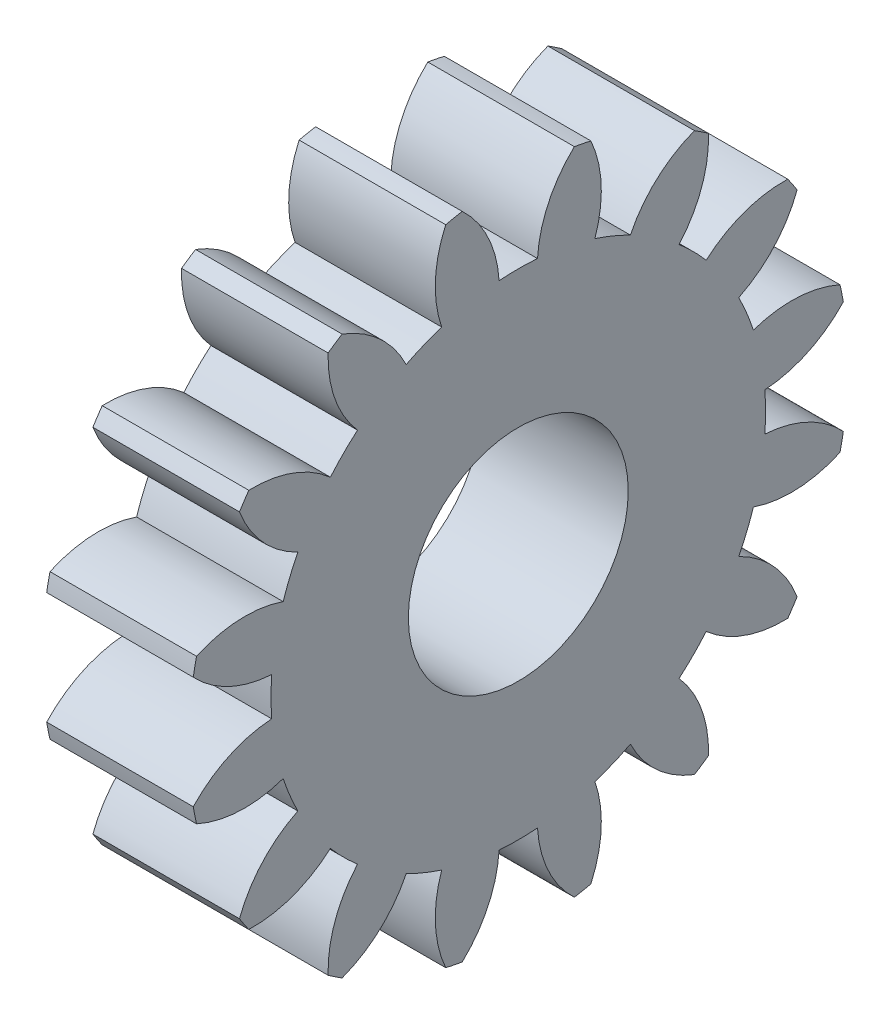
from build123d import *

# Parameters (mm, degrees)
BASPROSKE_W     = 2
BASPROSKE_H     = 4.5
TOOTHCUT_DEPTH  = 7.670832032
TEETHCUTS_COUNT = 16
TEETHCUTS_ANGLE = 337.5
BORSKE_R        = 1.5
BORE_DEPTH      = 50.0000508


with BuildPart() as part:
    # BasProSke → Base-Revolve (revolve)
    with BuildSketch(Plane(origin=(0, 0, 0), x_dir=(1, 0, 0), z_dir=(0, 1, 0)), mode=Mode.PRIVATE) as base_revolve_sk:
        with Locations((1, 2.25)):
            Rectangle(BASPROSKE_W, BASPROSKE_H)
    revolve(base_revolve_sk.sketch.rotate(Axis((-10, 0, 0), (1, 0, 0)), 180), axis=Axis((-10, 0, 0), (1, 0, 0)))

    # TooCutSke → ToothCut (cut, through all)
    with BuildSketch(Plane(origin=(0, 0, 0), x_dir=(0, 0, -1), z_dir=(1, 0, 0))):
        with BuildLine():
            ThreePointArc((0.261866103, 3.363822549), (0, 3.374), (-0.261866103, 3.363822549))
            ThreePointArc((-0.261866103, 3.363822549), (-0.417714668, 3.961827375), (-0.788562282, 4.456165918))
            ThreePointArc((-0.788562282, 4.456165918), (0, 4.5254), (0.788562282, 4.456165918))
            ThreePointArc((0.788562282, 4.456165918), (0.417714668, 3.961827375), (0.261866103, 3.363822549))
        make_face()
    toothcut = extrude(amount=TOOTHCUT_DEPTH, mode=Mode.SUBTRACT)

    # TeethCuts: ToothCut ×16 about axis
    teethcuts_axis = Axis((-10, 0, 0), (1, 0, 0))
    for i in range(1, TEETHCUTS_COUNT):
        add(toothcut.rotate(teethcuts_axis, i * TEETHCUTS_ANGLE / (TEETHCUTS_COUNT - 1)), mode=Mode.SUBTRACT)

    # BorSke → Bore (cut, symmetric)
    with BuildSketch(Plane(origin=(0, 0, 0), x_dir=(0, 0, -1), z_dir=(1, 0, 0))):
        with Locations(Location((0, 0, 0), (0, 0, 180))):
            Circle(BORSKE_R)
    extrude(amount=BORE_DEPTH, both=True, mode=Mode.SUBTRACT)


solid = part.part
